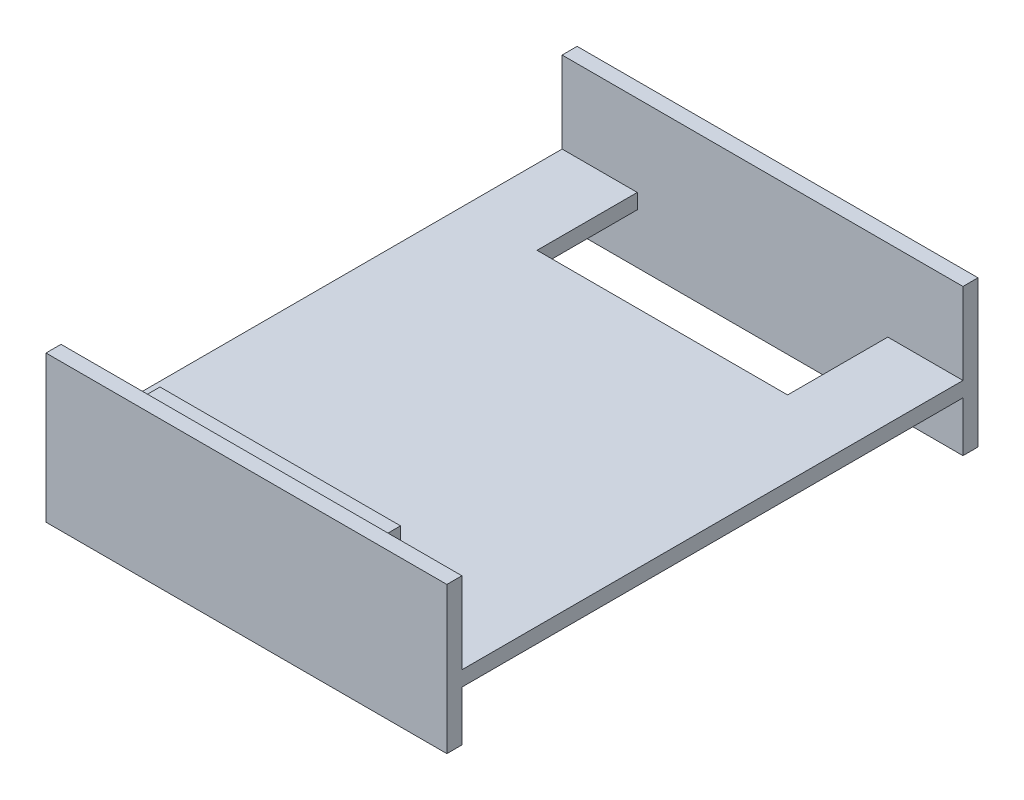
from build123d import *

# Parameters (mm, degrees)
EXTRUDE_309_DEPTH      = 1.2
SKETCH_2_W             = 32
SKETCH_2_H             = 1.2
PCB_DEPTH              = 6.5
PCB_2_DEPTH            = 6
CUT_EXTRUDE_1014_REACH = 54.571
SKETCH_5_W             = 32
SKETCH_5_H             = 1.2
EXTRUDE_1286_DEPTH     = 4


with BuildPart() as part:
    # 草图1 → Extrude 309 (new body)
    with BuildSketch(Plane(origin=(0, 0, 0), x_dir=(1, 0, 0), z_dir=(0, 1, 0))):
        Polygon((32, 0), (32, 40), (32, 41.2), (0, 41.2), (0, 40), (0, 0), (0, -1.2), (32, -1.2), align=None)
    extrude(amount=EXTRUDE_309_DEPTH)

    # 草图2 → PCB (add)
    with BuildSketch(Plane(origin=(0, 1.2, 0), x_dir=(1, 0, 0), z_dir=(0, 1, 0))):
        with Locations((16, -0.6)):
            Rectangle(SKETCH_2_W, SKETCH_2_H)
        with Locations((16, 40.6)):
            Rectangle(SKETCH_2_W, SKETCH_2_H)
    extrude(amount=PCB_DEPTH)

    # 草图3 → PCB 2 (add)
    with BuildSketch(Plane(origin=(0, 1.2, 0), x_dir=(1, 0, 0), z_dir=(0, 1, 0))):
        Polygon((16, 0), (25.6, 0), (25.6, 1.5), (6.4, 1.5), (6.4, 0), align=None)
    extrude(amount=PCB_2_DEPTH)

    # 草图4 → Cut-Extrude 1014 (cut, up to next)
    with BuildSketch(Plane(origin=(0, 1.2, 0), x_dir=(1, 0, 0), z_dir=(0, 1, 0)), mode=Mode.PRIVATE) as cut_extrude_1014_sk1:
        Polygon((16, 40), (26, 40), (26, 32), (6, 32), (6, 40), align=None)
    cut_extrude_1014_tool1 = extrude(cut_extrude_1014_sk1.sketch, amount=-CUT_EXTRUDE_1014_REACH, mode=Mode.PRIVATE) & part.part
    add(cut_extrude_1014_tool1.solids().sort_by_distance((16, 1.2, -36))[0], mode=Mode.SUBTRACT)

    # 草图5 → Extrude 1286 (add)
    with BuildSketch(Plane.XZ):
        with Locations((16, 0.6)):
            Rectangle(SKETCH_5_W, SKETCH_5_H)
        with Locations((16, -40.6)):
            Rectangle(SKETCH_5_W, SKETCH_5_H)
    extrude(amount=EXTRUDE_1286_DEPTH)


solid = part.part
